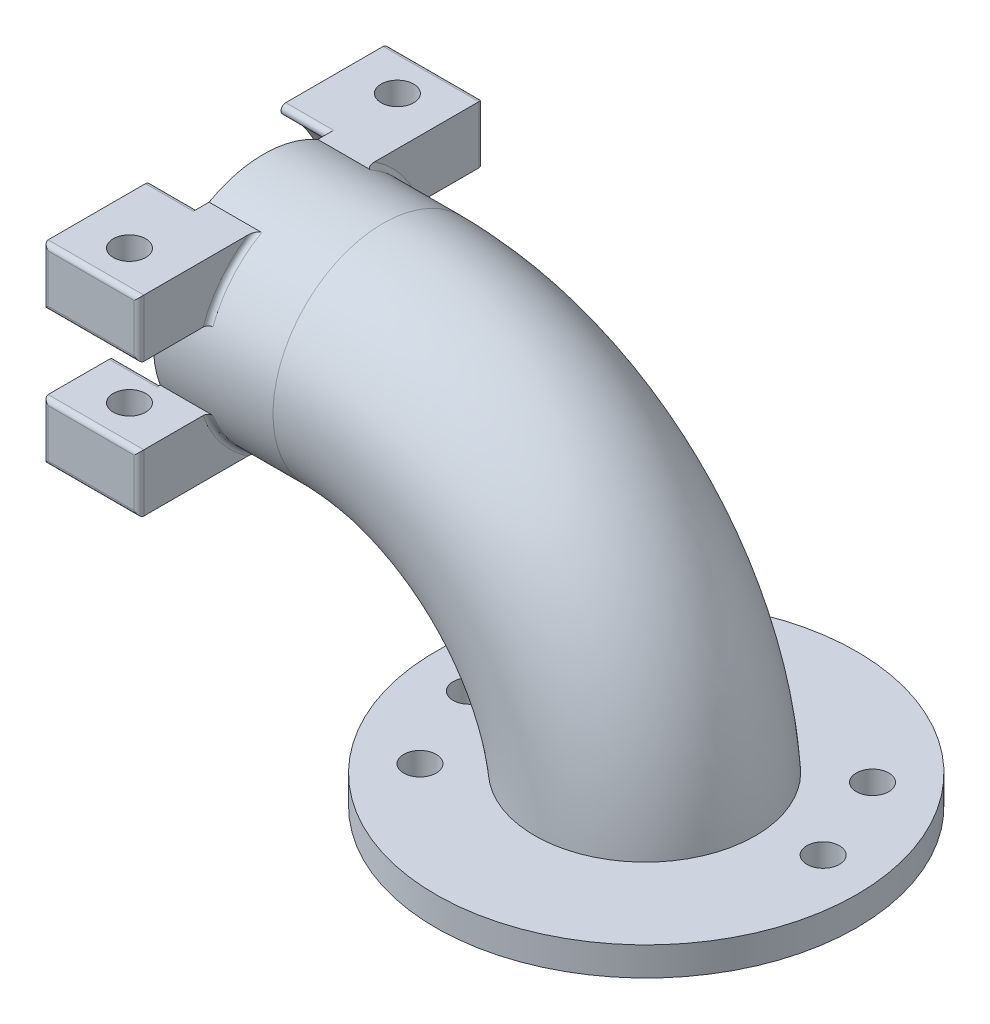
from build123d import *

# Parameters (mm, degrees)
SWEEP_1_PROFILE_R   = 11.5
SWEEP_1_PROFILE_R_2 = 9
EXTRUDE_1_DEPTH     = 5
SKETCH_31_R         = 1.7
CUT_EXTRUDE_1_DEPTH = 26
FILLET_1_R          = 0.5
SKETCH_32_R         = 22
SKETCH_32_R_2       = 9
EXTRUDE_5_DEPTH     = 3
EXTRUDE_START       = 3
SKETCH_33_R         = 12
SKETCH_33_R_2       = 9
EXTRUDE_6_DEPTH     = 3
SKETCH_34_R         = 1.7
CUT_EXTRUDE_2_DEPTH = 10


with BuildPart() as part:
    # 扫描-薄件1: sweep along a path in 草图1
    with BuildLine(Plane.XY) as sweep_1_path:
        Line((-40, 27.5), (-27.5, 27.5))
        ThreePointArc((-27.5, 27.5), (-8.054563517, 19.445436483), (0, 0))
    # 扫描-薄件1 profile (on start of the path) → 扫描-薄件1 (sweep)
    with BuildSketch(Plane(origin=(-40, 27.5, 0), x_dir=(0, 1, 0), z_dir=(1, 0, 0))):
        Circle(SWEEP_1_PROFILE_R)
        Circle(SWEEP_1_PROFILE_R_2, mode=Mode.SUBTRACT)
    sweep(path=sweep_1_path.line)

    # 草图30 → 凸台-拉伸1 (add, symmetric)
    with BuildSketch(Plane.ZY.offset(40)):
        with BuildLine():
            ThreePointArc((-10.781929326, 31.5), (-8.76012524, 34.950517149), (-5.678908346, 37.5))
            Line((-5.678908346, 37.5), (-18, 37.5))
            Line((-18, 37.5), (-18, 31.5))
            Line((-18, 31.5), (-10.781929326, 31.5))
        make_face()
        with BuildLine():
            ThreePointArc((-5.678908346, 17.5), (-8.76012524, 20.049482851), (-10.781929326, 23.5))
            Line((-10.781929326, 23.5), (-18, 23.5))
            Line((-18, 23.5), (-18, 17.5))
            Line((-18, 17.5), (-5.678908346, 17.5))
        make_face()
        with BuildLine():
            Line((18, 37.5), (5.678908346, 37.5))
            ThreePointArc((5.678908346, 37.5), (8.76012524, 34.950517149), (10.781929326, 31.5))
            Line((10.781929326, 31.5), (18, 31.5))
            Line((18, 31.5), (18, 37.5))
        make_face()
        with BuildLine():
            Line((18, 17.5), (18, 23.5))
            Line((18, 23.5), (10.781929326, 23.5))
            ThreePointArc((10.781929326, 23.5), (8.76012524, 20.049482851), (5.678908346, 17.5))
            Line((5.678908346, 17.5), (18, 17.5))
        make_face()
    extrude(amount=EXTRUDE_1_DEPTH, both=True)

    # 草图31 → 切除-拉伸1 (cut)
    with BuildSketch(Plane(origin=(0, 37.5, 0), x_dir=(1, 0, 0), z_dir=(0, 1, 0))):
        with Locations(Location((-40, 14, 0), (0, 0, 180))):
            Circle(SKETCH_31_R)
        with Locations(Location((-40, -14, 0), (0, 0, 180))):
            Circle(SKETCH_31_R)
    extrude(amount=-CUT_EXTRUDE_1_DEPTH, mode=Mode.SUBTRACT)

    # 圆角1
    fillet_1_edges = [part.edges().sort_by_distance(p)[0] for p in [
        (-40, 37.5, -18),
        (-45, 34.5, -18),
        (-40, 31.5, -18),
        (-35, 34.5, -18),
        (-40, 31.5, 18),
        (-45, 34.5, 18),
        (-40, 37.5, 18),
        (-35, 34.5, 18),
        (-40, 17.5, 18),
        (-45, 20.5, 18),
        (-40, 23.5, 18),
        (-35, 20.5, 18),
        (-40, 23.5, -18),
        (-45, 20.5, -18),
        (-40, 17.5, -18),
        (-35, 20.5, -18),
        (-42.5, 23.5, 10.781929326),
        (-42.5, 23.5, -10.781929326),
        (-42.5, 31.5, -10.781929326),
        (-42.5, 17.5, 5.678908346),
        (-42.5, 17.5, -5.678908346),
        (-42.5, 37.5, 5.678908346),
        (-42.5, 37.5, -5.678908346),
        (-35, 20.049482851, 8.76012524),
        (-35, 34.950517149, 8.76012524),
        (-35, 20.049482851, -8.76012524),
        (-35, 34.950517149, -8.76012524),
    ]]
    fillet(fillet_1_edges, radius=FILLET_1_R)

    # 草图32 → 凸台-拉伸5 (add)
    with BuildSketch(Plane.XZ):
        Circle(SKETCH_32_R)
        Circle(SKETCH_32_R_2, mode=Mode.SUBTRACT)
    extrude(amount=-EXTRUDE_5_DEPTH)

    # 草图33 → 凸台-拉伸6 (add)
    with BuildSketch(Plane.XZ.offset(EXTRUDE_START)):
        Circle(SKETCH_33_R)
        Circle(SKETCH_33_R_2, mode=Mode.SUBTRACT)
    extrude(amount=-EXTRUDE_6_DEPTH)

    # 草图34 → 切除-拉伸2 (cut)
    with BuildSketch(Plane.XZ):
        with Locations((-12.664726672, 10.981465686)):
            Circle(SKETCH_34_R)
        with Locations((-16.663757776, 1.818534314)):
            Circle(SKETCH_34_R)
        with Locations((16.663757776, -1.818534314)):
            Circle(SKETCH_34_R)
        with Locations((12.664726672, -10.981465686)):
            Circle(SKETCH_34_R)
    extrude(amount=-CUT_EXTRUDE_2_DEPTH, mode=Mode.SUBTRACT)


solid = part.part
